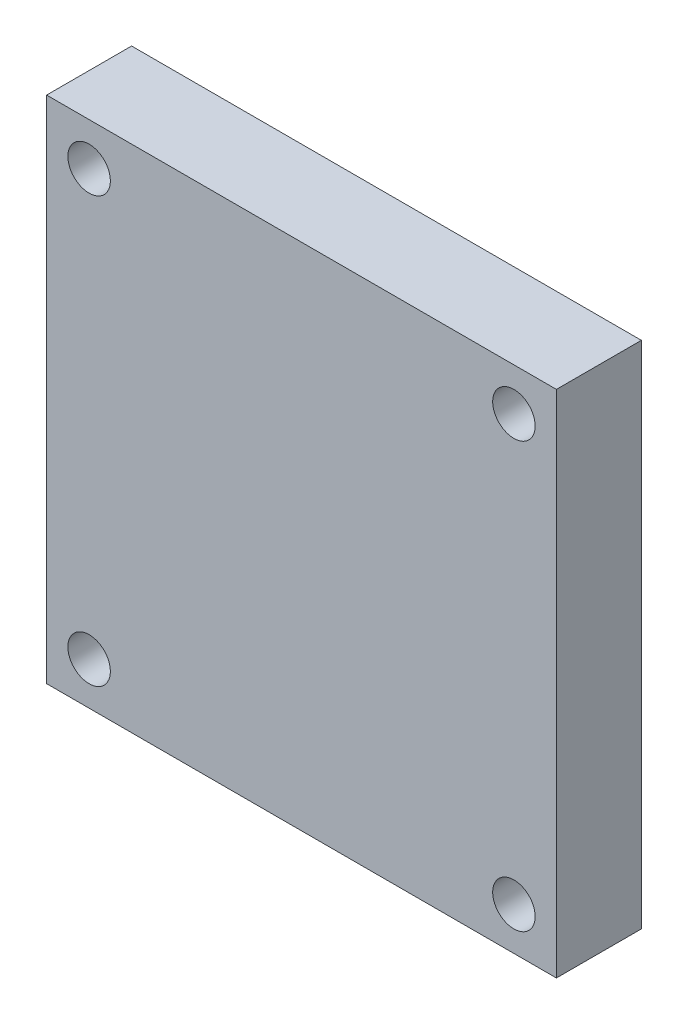
from build123d import *

# Parameters (mm, degrees)
SKETCH2_W           = 60
SKETCH2_H           = 60
SKETCH2_R           = 2.5
BOSS_EXTRUDE1_DEPTH = 10


with BuildPart() as part:
    # Sketch2 → Boss-Extrude1 (new body)
    with BuildSketch(Plane.XY):
        Rectangle(SKETCH2_W, SKETCH2_H)
        with Locations((-25, 25)):
            Circle(SKETCH2_R, mode=Mode.SUBTRACT)
        with Locations((25, 25)):
            Circle(SKETCH2_R, mode=Mode.SUBTRACT)
        with Locations((25, -25)):
            Circle(SKETCH2_R, mode=Mode.SUBTRACT)
        with Locations((-25, -25)):
            Circle(SKETCH2_R, mode=Mode.SUBTRACT)
    extrude(amount=BOSS_EXTRUDE1_DEPTH)


solid = part.part
